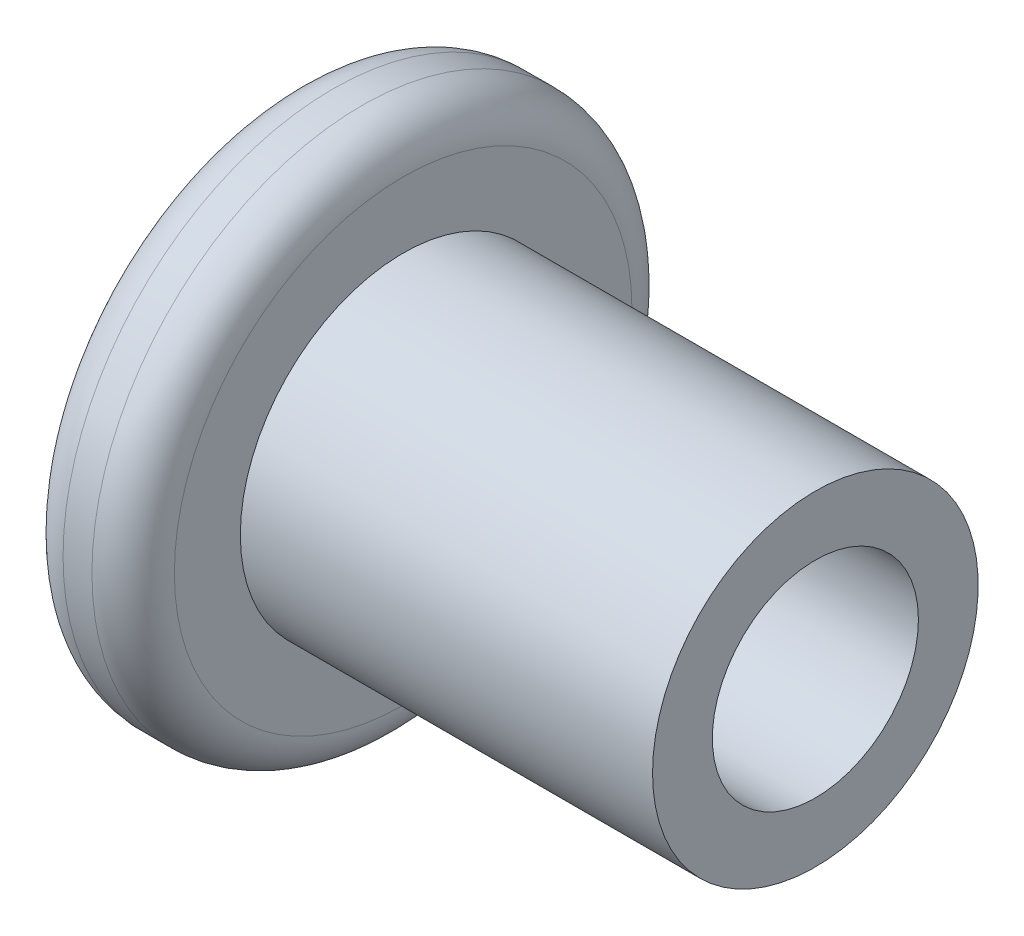
from build123d import *

# Parameters (mm, degrees)
FILLET_1_R             = 1
CUT_EXTRUDE_1_DEPTH    = 1
HOLE_WIZARD_M6_1_D     = 5
HOLE_WIZARD_M6_1_DEPTH = 4.1
HOLE_WIZARD_M6_1_TIP   = 1.502151548


with BuildPart() as part:
    # 草图1 → 旋转1 (revolve)
    with BuildSketch(Plane.XY, mode=Mode.PRIVATE) as revolve_1_sk:
        Polygon((0, 0), (0, 6.55), (2.7, 6.55), (2.7, 3.95), (12.7, 3.95), (12.7, 0), align=None)
    revolve(revolve_1_sk.sketch.rotate(Axis((0, 0, 0), (1, 0, 0)), 90), axis=Axis((0, 0, 0), (1, 0, 0)))

    # 圆角1
    fillet_1_edges = [part.edges().sort_by_distance(p)[0] for p in [
        (2.7, 0, -6.55),
        (0, 0, -6.55),
    ]]
    fillet(fillet_1_edges, radius=FILLET_1_R)

    # 草图2 → 切除-拉伸1 (cut)
    with BuildSketch(Plane.ZY):
        Polygon((1.154700538, 2), (-1.154700538, 2), (-2.309401077, 0), (-1.154700538, -2), (1.154700538, -2), (2.309401077, 0), align=None)
    extrude(amount=-CUT_EXTRUDE_1_DEPTH, mode=Mode.SUBTRACT)

    # M6 螺纹孔1
    with Locations(Plane(origin=(12.7, 0, 0), x_dir=(0, 0, -1), z_dir=(1, 0, 0))):
        with Locations((0, 0)):
            Hole(HOLE_WIZARD_M6_1_D / 2, depth=HOLE_WIZARD_M6_1_DEPTH)
            with Locations((0, 0, -(HOLE_WIZARD_M6_1_DEPTH + HOLE_WIZARD_M6_1_TIP / 2))):  # 118° drill point
                Cone(0, HOLE_WIZARD_M6_1_D / 2, HOLE_WIZARD_M6_1_TIP, mode=Mode.SUBTRACT)


solid = part.part
